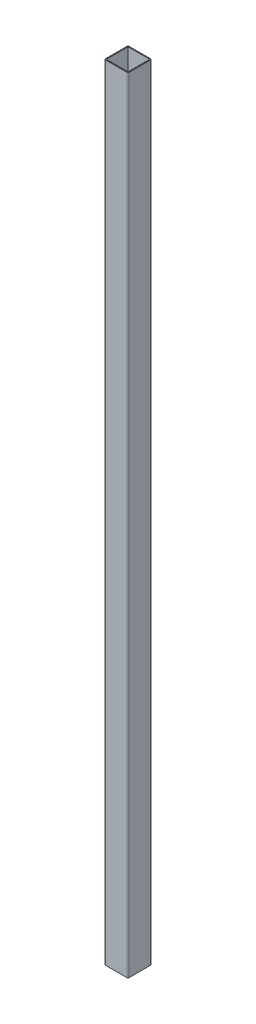
from build123d import *

# Parameters (mm, degrees)
F_8639_82_150_X_150_X_7_0_1_DEPTH = 5328


with BuildPart() as part:
    # Sketch1 → Квадратная труба гост 8639-82 150 X 150 X 7.0(1) (new body)
    with BuildSketch(Plane.XZ):
        with BuildLine():
            Line((-73.999, -80), (73.999, -80))
            ThreePointArc((73.999, -80), (78.242347794, -78.242347794), (80, -73.999))
            Line((80, -73.999), (80, 73.999))
            ThreePointArc((80, 73.999), (78.242347794, 78.242347794), (73.999, 80))
            Line((73.999, 80), (-73.999, 80))
            ThreePointArc((-73.999, 80), (-78.242347794, 78.242347794), (-80, 73.999))
            Line((-80, 73.999), (-80, -73.999))
            ThreePointArc((-80, -73.999), (-78.242347794, -78.242347794), (-73.999, -80))
        make_face()
        with BuildLine():
            Line((-73.999, -74), (73.999, -74))
            ThreePointArc((73.999, -74), (73.999707107, -73.999707107), (74, -73.999))
            Line((74, -73.999), (74, 73.999))
            ThreePointArc((74, 73.999), (73.999707107, 73.999707107), (73.999, 74))
            Line((73.999, 74), (-73.999, 74))
            ThreePointArc((-73.999, 74), (-73.999707107, 73.999707107), (-74, 73.999))
            Line((-74, 73.999), (-74, -73.999))
            ThreePointArc((-74, -73.999), (-73.999707107, -73.999707107), (-73.999, -74))
        make_face(mode=Mode.SUBTRACT)
    extrude(amount=F_8639_82_150_X_150_X_7_0_1_DEPTH)


solid = part.part
